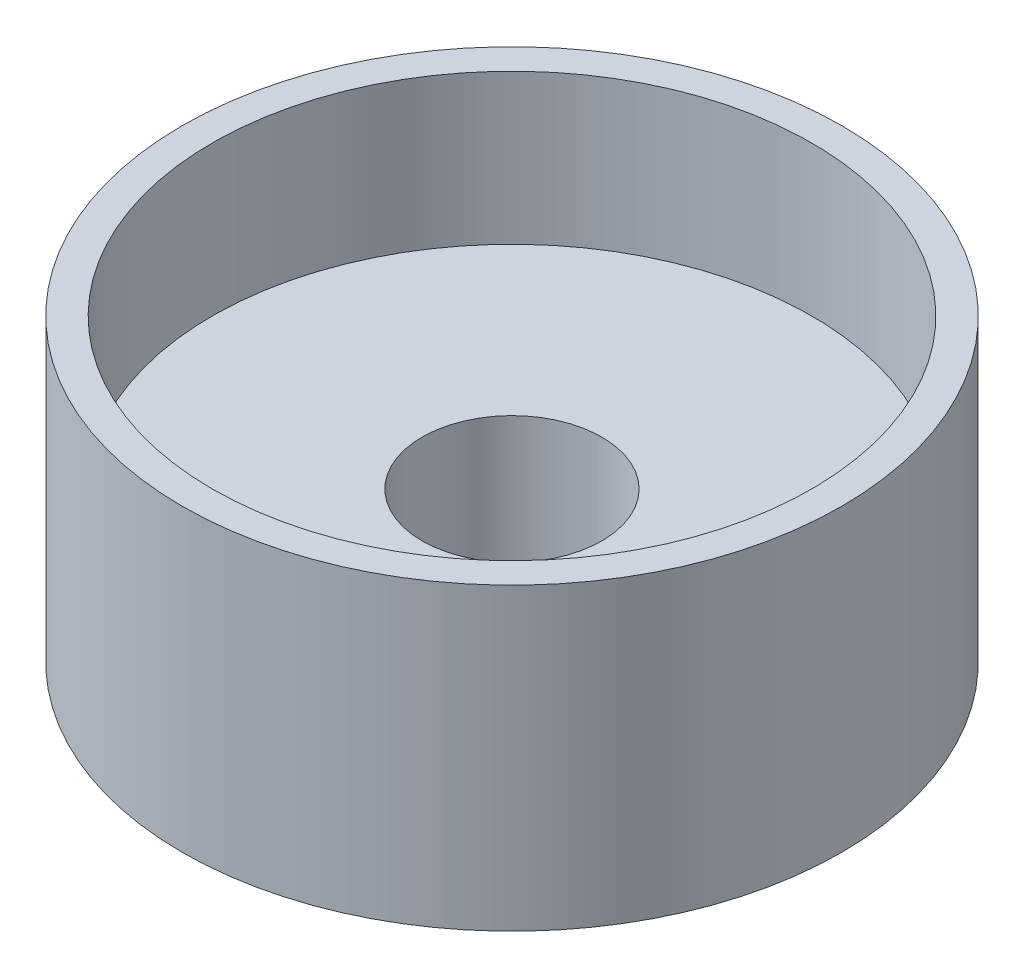
from build123d import *

# Parameters (mm, degrees)
SKETCH1_R           = 11
BOSS_EXTRUDE1_DEPTH = 10
SKETCH2_R           = 3
CUT_EXTRUDE1_DEPTH  = 20
SKETCH5_R           = 10
CUT_EXTRUDE3_DEPTH  = 5


with BuildPart() as part:
    # Sketch1 → Boss-Extrude1 (new body)
    with BuildSketch(Plane(origin=(0, 0, 0), x_dir=(1, 0, 0), z_dir=(0, 1, 0))):
        with Locations(Location((0, 0, 0), (0, 0, 270))):
            Circle(SKETCH1_R)
    extrude(amount=BOSS_EXTRUDE1_DEPTH)

    # Sketch2 → Cut-Extrude1 (cut)
    with BuildSketch(Plane(origin=(0, 0, 0), x_dir=(1, 0, 0), z_dir=(0, 1, 0))):
        with Locations(Location((0, 0, 0), (0, 0, 270))):
            Circle(SKETCH2_R)
    extrude(amount=CUT_EXTRUDE1_DEPTH, mode=Mode.SUBTRACT)

    # Sketch5 → Cut-Extrude3 (cut)
    with BuildSketch(Plane(origin=(0, 10, 0), x_dir=(1, 0, 0), z_dir=(0, 1, 0))):
        with Locations(Location((0, 0, 0), (0, 0, 270))):
            Circle(SKETCH5_R)
    extrude(amount=-CUT_EXTRUDE3_DEPTH, mode=Mode.SUBTRACT)


solid = part.part
